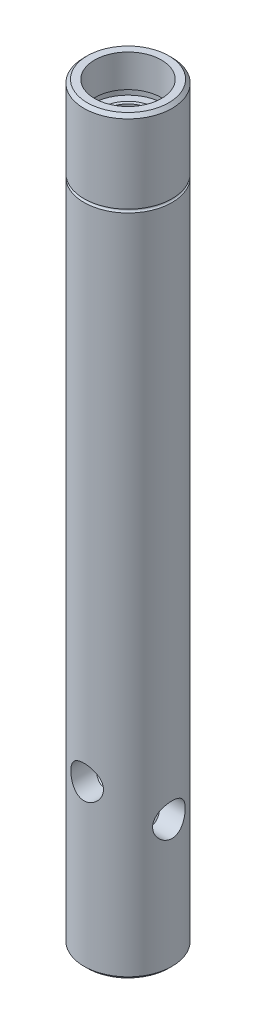
from build123d import *
from build123d.topology import SkipClean

# Parameters (mm, degrees)
SKETCH_5_R          = 8
SKETCH_5_R_2        = 7
EXTRUDE_1_DEPTH     = 0.5
CHAMFER_2_SIZE      = 1
SKETCH_6_R          = 11
SKETCH_6_R_2        = 10.25
CUT_EXTRUDE_2_DEPTH = 2
CHAMFER_3_SIZE      = 1
SKETCH_9_R          = 5
CUT_EXTRUDE_3_DEPTH = 232.972519924
SKETCH_10_R         = 5
CUT_EXTRUDE_4_DEPTH = 232.972519942


with BuildPart() as part:
    # Эскиз1 → Повернуть1 (revolve)
    with BuildSketch(Plane.XY, mode=Mode.PRIVATE) as revolve_1_sk:
        with BuildLine():
            Line((13.5, 0), (13.5, 204))
            ThreePointArc((13.5, 204), (13, 204.5), (13.5, 205))
            Line((13.5, 205), (13.5, 230))
            Line((13.5, 230), (10.25, 230))
            Line((10.25, 230), (10.25, 218))
            Line((10.25, 218), (7, 218))
            Line((7, 218), (7, 24.041451884))
            Line((7, 24.041451884), (0, 20))
            Line((0, 20), (0, 0))
            Line((0, 0), (13.5, 0))
        make_face()
    revolve(revolve_1_sk.sketch.rotate(Axis((0, 0, 0), (0, 1, 0)), 90), axis=Axis((0, 0, 0), (0, 1, 0)))

    # Эскиз5 → Вытянуть1 (add)
    with BuildSketch(Plane(origin=(0, 218, 0), x_dir=(1, 0, 0), z_dir=(0, 1, 0))):
        with Locations(Location((0, 0, 0), (0, 0, 270))):
            Circle(SKETCH_5_R)
        with Locations(Location((0, 0, 0), (0, 0, 270))):
            Circle(SKETCH_5_R_2, mode=Mode.SUBTRACT)
    extrude(amount=EXTRUDE_1_DEPTH)

    # Фаска2
    chamfer_2_edges = [part.edges().sort_by_distance(p)[0] for p in [
        (0, 230, 13.5),
    ]]
    chamfer(chamfer_2_edges, length=CHAMFER_2_SIZE)

    # Эскиз6 → Вытянуть2 (cut)
    with BuildSketch(Plane(origin=(0, 218, 0), x_dir=(1, 0, 0), z_dir=(0, 1, 0))):
        with Locations(Location((0, 0, 0), (0, 0, 270))):
            Circle(SKETCH_6_R)
        with Locations(Location((0, 0, 0), (0, 0, 90))):
            Circle(SKETCH_6_R_2, mode=Mode.SUBTRACT)
    extrude(amount=CUT_EXTRUDE_2_DEPTH, mode=Mode.SUBTRACT)

    # Фаска3
    chamfer_3_edges = [part.edges().sort_by_distance(p)[0] for p in [
        (0, 0, 13.5),
    ]]
    chamfer(chamfer_3_edges, length=CHAMFER_3_SIZE)

    # Эскиз9 → Вытянуть3 (cut, through all)
    with BuildSketch(Plane(origin=(13.5, 0, 0), x_dir=(0, 0, -1), z_dir=(1, 0, 0))):
        with Locations((0, 40)):
            Circle(SKETCH_9_R)
    extrude(amount=-CUT_EXTRUDE_3_DEPTH, mode=Mode.SUBTRACT)

    # Эскиз10 → Вытянуть4 (cut, through all)
    with SkipClean():  # the faces are left unmerged after this step: merging them gives an invalid solid
        with BuildSketch(Plane.XY.offset(13.5)):
            with Locations((0, 50)):
                Circle(SKETCH_10_R)
        extrude(amount=-CUT_EXTRUDE_4_DEPTH, mode=Mode.SUBTRACT)


solid = part.part
